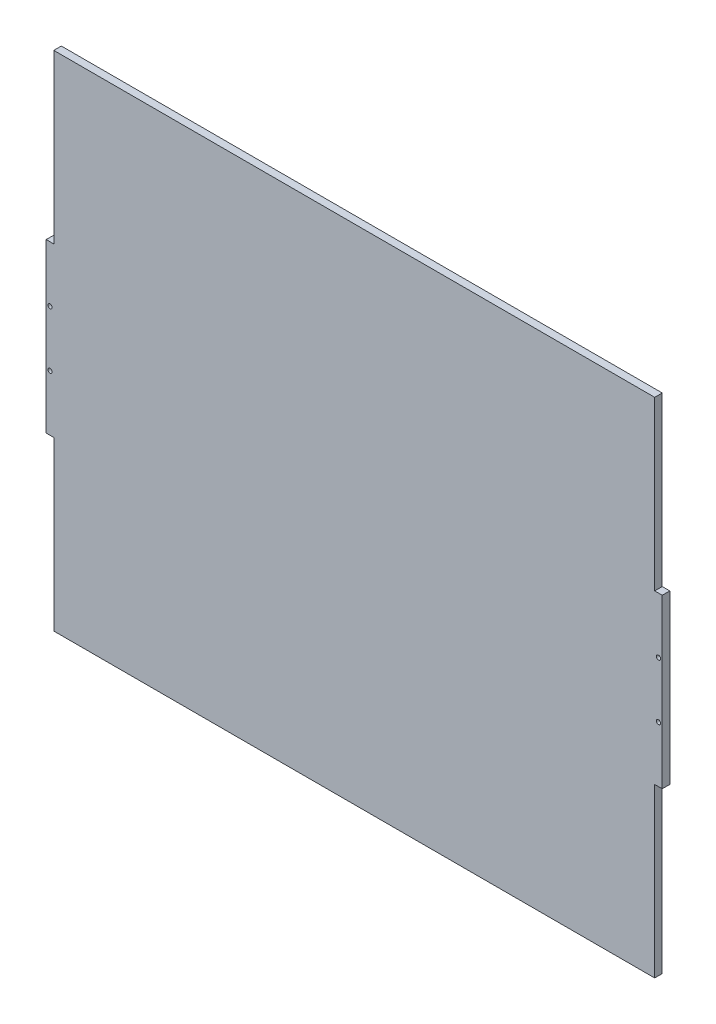
from build123d import *

# Parameters (mm, degrees)
SKETCH1_W            = 490
SKETCH1_H            = 400
BOSS_EXTRUDE1_DEPTH  = 6
SKETCH2_W            = 6
SKETCH2_H            = 133.333333333
CUT_EXTRUDE1_DEPTH   = 12
M3_CLEARANCE_HOLE1_D = 3.4


with BuildPart() as part:
    # Sketch1 → Boss-Extrude1 (new body)
    with BuildSketch(Plane.XY):
        with Locations((245, 200)):
            Rectangle(SKETCH1_W, SKETCH1_H)
    extrude(amount=BOSS_EXTRUDE1_DEPTH)

    # Sketch2 → Cut-Extrude1 (cut)
    with BuildSketch(Plane.XY.offset(6)):
        with Locations((487, 333.333333334)):
            Rectangle(SKETCH2_W, SKETCH2_H)
        with Locations((3, 333.333333334)):
            Rectangle(SKETCH2_W, SKETCH2_H)
        with Locations((3, 66.666666667)):
            Rectangle(SKETCH2_W, SKETCH2_H)
        with Locations((487, 66.666666667)):
            Rectangle(SKETCH2_W, SKETCH2_H)
    extrude(amount=-CUT_EXTRUDE1_DEPTH, mode=Mode.SUBTRACT)

    # M3 Clearance Hole1 (through all)
    with Locations(Plane.XY.offset(6)):
        with Locations((3, 222.223333333), (3, 177.776666667), (487, 222.223333333), (487, 177.776666667)):
            Hole(M3_CLEARANCE_HOLE1_D / 2)


solid = part.part
